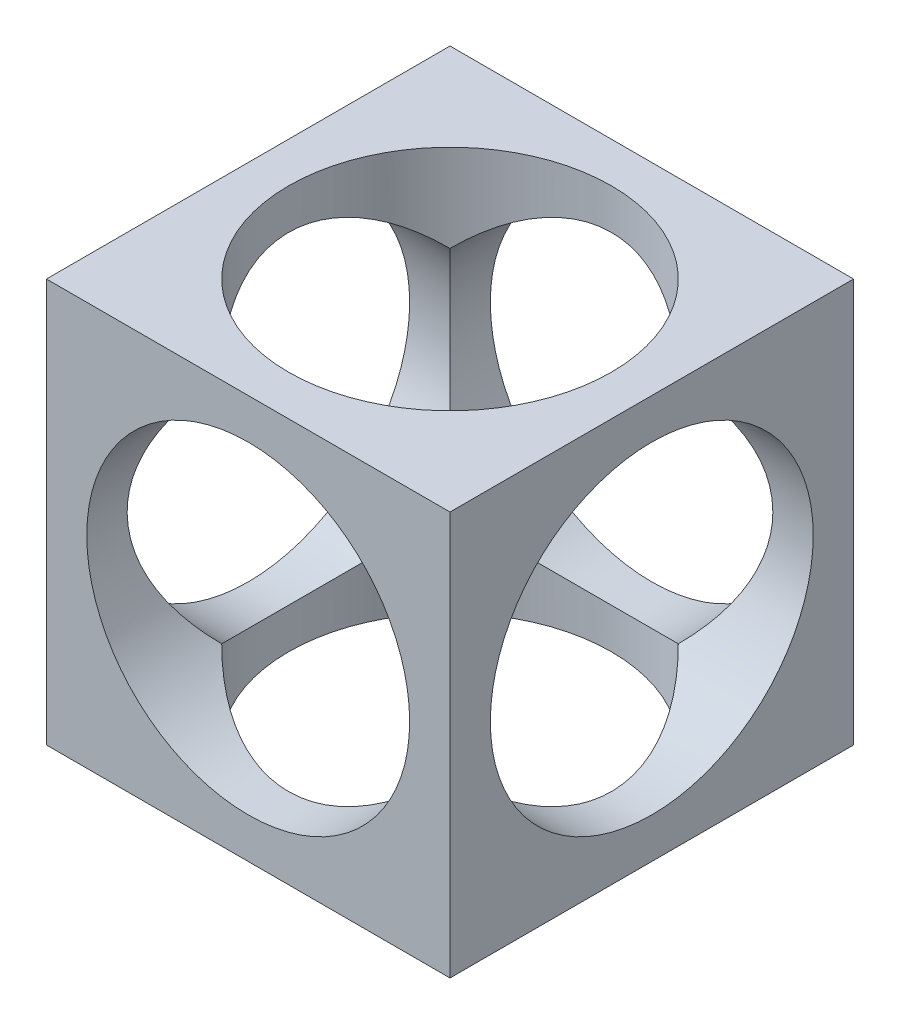
from build123d import *

# Parameters (mm, degrees)
CROQUIS1_W              = 100
CROQUIS1_H              = 100
SALIENTE_EXTRUIR1_DEPTH = 100
CROQUIS2_R              = 40
CORTAR_EXTRUIR1_DEPTH   = 100
CROQUIS3_R              = 40
CORTAR_EXTRUIR2_DEPTH   = 100
CROQUIS4_R              = 40
CORTAR_EXTRUIR3_DEPTH   = 100


with BuildPart() as part:
    # Croquis1 → Saliente-Extruir1 (new body)
    with BuildSketch(Plane.XY):
        with Locations((50, 50)):
            Rectangle(CROQUIS1_W, CROQUIS1_H)
    extrude(amount=SALIENTE_EXTRUIR1_DEPTH)

    # Croquis2 → Cortar-Extruir1 (cut)
    with BuildSketch(Plane.XY.offset(100)):
        with Locations((50, 50)):
            Circle(CROQUIS2_R)
    extrude(amount=-CORTAR_EXTRUIR1_DEPTH, mode=Mode.SUBTRACT)

    # Croquis3 → Cortar-Extruir2 (cut)
    with BuildSketch(Plane(origin=(100, 0, 0), x_dir=(0, 0, -1), z_dir=(1, 0, 0))):
        with Locations((-50, 50)):
            Circle(CROQUIS3_R)
    extrude(amount=-CORTAR_EXTRUIR2_DEPTH, mode=Mode.SUBTRACT)

    # Croquis4 → Cortar-Extruir3 (cut)
    with BuildSketch(Plane(origin=(0, 100, 0), x_dir=(1, 0, 0), z_dir=(0, 1, 0))):
        with Locations(Location((50, -50, 0), (0, 0, 270))):
            Circle(CROQUIS4_R)
    extrude(amount=-CORTAR_EXTRUIR3_DEPTH, mode=Mode.SUBTRACT)


solid = part.part
